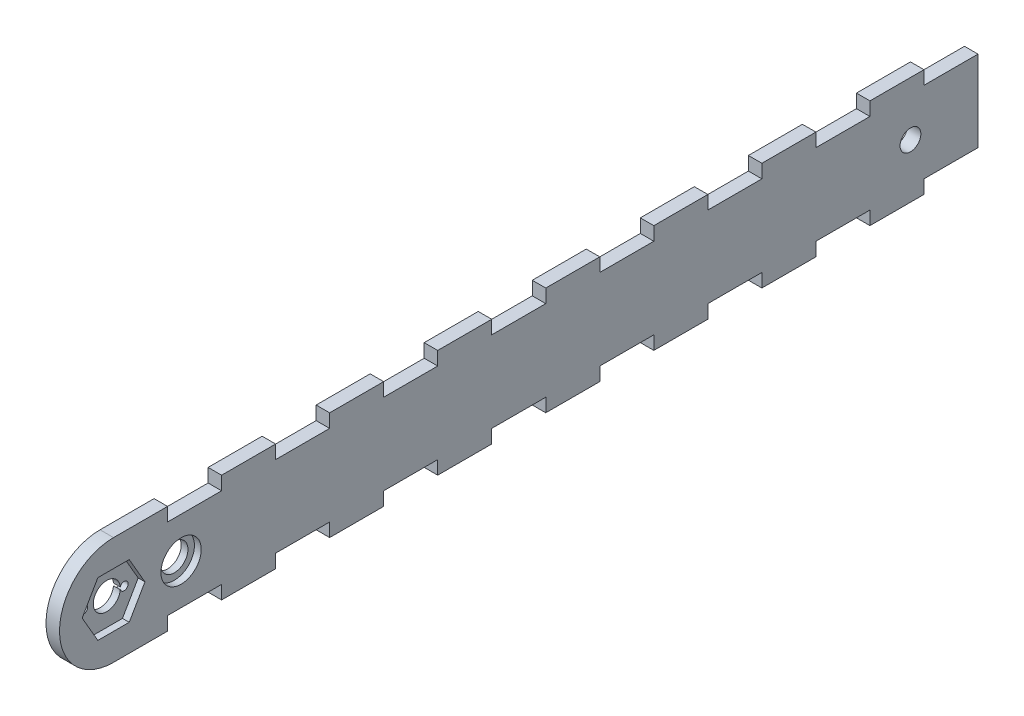
from build123d import *

# Parameters (mm, degrees)
SKETCH1_R           = 3.175
BOSS_EXTRUDE1_DEPTH = 3.175
SKETCH2_R           = 3.2004
SKETCH2_R_2         = 2.4384
CUT_EXTRUDE2_DEPTH  = 204.621243059
SKETCH3_R           = 4.73075
CUT_EXTRUDE3_DEPTH  = 1.5875
SKETCH5_R           = 0.9525
CUT_EXTRUDE4_DEPTH  = 204.621243059


with BuildPart() as part:
    # Sketch1 → Boss-Extrude1 (new body)
    with BuildSketch(Plane(origin=(0, 0, 0), x_dir=(0, 0, -1), z_dir=(1, 0, 0))):
        with BuildLine():
            Line((12.7, 12.7), (0, 12.7))
            ThreePointArc((0, 12.7), (-12.7, 0), (0, -12.7))
            Line((0, -12.7), (12.7, -12.7))
            Line((12.7, -12.7), (12.7, -9.525))
            Line((12.7, -9.525), (25.4, -9.525))
            Line((25.4, -9.525), (25.4, -12.7))
            Line((25.4, -12.7), (38.1, -12.7))
            Line((38.1, -12.7), (38.1, -9.525))
            Line((38.1, -9.525), (50.8, -9.525))
            Line((50.8, -9.525), (50.8, -12.7))
            Line((50.8, -12.7), (63.5, -12.7))
            Line((63.5, -12.7), (63.5, -9.525))
            Line((63.5, -9.525), (76.2, -9.525))
            Line((76.2, -9.525), (76.2, -12.7))
            Line((76.2, -12.7), (88.9, -12.7))
            Line((88.9, -12.7), (88.9, -9.525))
            Line((88.9, -9.525), (101.6, -9.525))
            Line((101.6, -9.525), (101.6, -12.7))
            Line((101.6, -12.7), (114.3, -12.7))
            Line((114.3, -12.7), (114.3, -9.525))
            Line((114.3, -9.525), (127, -9.525))
            Line((127, -9.525), (127, -12.7))
            Line((127, -12.7), (139.7, -12.7))
            Line((139.7, -12.7), (139.7, -9.525))
            Line((139.7, -9.525), (152.4, -9.525))
            Line((152.4, -9.525), (152.4, -12.7))
            Line((152.4, -12.7), (165.1, -12.7))
            Line((165.1, -12.7), (165.1, -9.525))
            Line((165.1, -9.525), (177.8, -9.525))
            Line((177.8, -9.525), (177.8, -12.7))
            Line((177.8, -12.7), (190.5, -12.7))
            Line((190.5, -12.7), (190.5, -9.525))
            Line((190.5, -9.525), (203.2, -9.525))
            Line((203.2, -9.525), (203.2, 9.525))
            Line((203.2, 9.525), (190.5, 9.525))
            Line((190.5, 9.525), (190.5, 12.7))
            Line((190.5, 12.7), (177.8, 12.7))
            Line((177.8, 12.7), (177.8, 9.525))
            Line((177.8, 9.525), (165.1, 9.525))
            Line((165.1, 9.525), (165.1, 12.7))
            Line((165.1, 12.7), (152.4, 12.7))
            Line((152.4, 12.7), (152.4, 9.525))
            Line((152.4, 9.525), (139.7, 9.525))
            Line((139.7, 9.525), (139.7, 12.7))
            Line((139.7, 12.7), (127, 12.7))
            Line((127, 12.7), (127, 9.525))
            Line((127, 9.525), (114.3, 9.525))
            Line((114.3, 9.525), (114.3, 12.7))
            Line((114.3, 12.7), (101.6, 12.7))
            Line((101.6, 12.7), (101.6, 9.525))
            Line((101.6, 9.525), (88.9, 9.525))
            Line((88.9, 9.525), (88.9, 12.7))
            Line((88.9, 12.7), (76.2, 12.7))
            Line((76.2, 12.7), (76.2, 9.525))
            Line((76.2, 9.525), (63.5, 9.525))
            Line((63.5, 9.525), (63.5, 12.7))
            Line((63.5, 12.7), (50.8, 12.7))
            Line((50.8, 12.7), (50.8, 9.525))
            Line((50.8, 9.525), (38.1, 9.525))
            Line((38.1, 9.525), (38.1, 12.7))
            Line((38.1, 12.7), (25.4, 12.7))
            Line((25.4, 12.7), (25.4, 9.525))
            Line((25.4, 9.525), (12.7, 9.525))
            Line((12.7, 9.525), (12.7, 12.7))
        make_face()
        Circle(SKETCH1_R, mode=Mode.SUBTRACT)
    extrude(amount=BOSS_EXTRUDE1_DEPTH)

    # Sketch2 → Cut-Extrude2 (cut, through all)
    with BuildSketch(Plane(origin=(3.175, 0, 0), x_dir=(0, 0, -1), z_dir=(1, 0, 0))):
        with Locations((15.875, 0)):
            Circle(SKETCH2_R)
        with Locations((187.325, 0)):
            Circle(SKETCH2_R_2)
    extrude(amount=-CUT_EXTRUDE2_DEPTH, mode=Mode.SUBTRACT)

    # Sketch3 → Cut-Extrude3 (cut)
    with BuildSketch(Plane(origin=(3.175, 0, 0), x_dir=(0, 0, -1), z_dir=(1, 0, 0))):
        with Locations((15.875, 0)):
            Circle(SKETCH3_R)
        Polygon((3.688171255, -6.3881), (7.376342509, 0), (3.688171255, 6.3881), (-3.688171255, 6.3881), (-7.376342509, 0), (-3.688171255, -6.3881), align=None)
    extrude(amount=-CUT_EXTRUDE3_DEPTH, mode=Mode.SUBTRACT)

    # Sketch5 → Cut-Extrude4 (cut, through all)
    with BuildSketch(Plane(origin=(3.175, 0, 0), x_dir=(0, 0, -1), z_dir=(1, 0, 0))):
        with Locations((-5.450627375, 0)):
            Circle(SKETCH5_R)
        with Locations((4.074372625, 0)):
            Circle(SKETCH5_R)
    extrude(amount=-CUT_EXTRUDE4_DEPTH, mode=Mode.SUBTRACT)


solid = part.part
